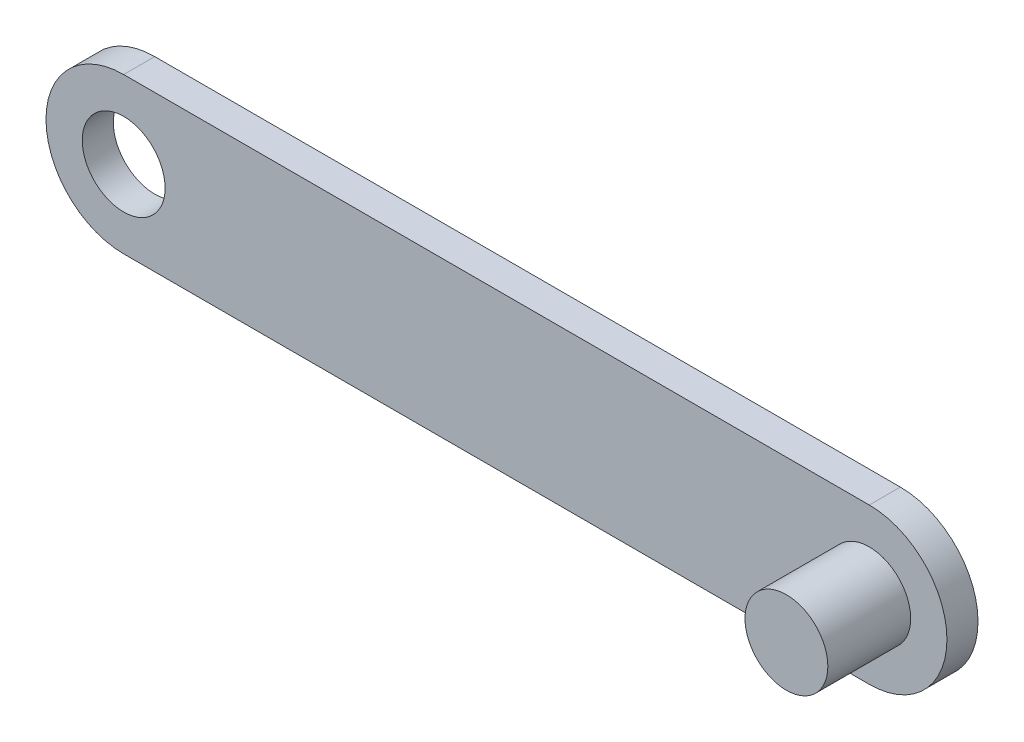
from build123d import *

# Parameters (mm, degrees)
BOSS_EXTRUDE4_DEPTH = 3
SKETCH4_R           = 4
CUT_EXTRUDE1_DEPTH  = 80.909323611
SKETCH5_R           = 4
BOSS_EXTRUDE5_DEPTH = 8


with BuildPart() as part:
    # Sketch1 → Boss-Extrude4 (new body)
    with BuildSketch(Plane.XY):
        with BuildLine():
            Line((0, 7.5), (72, 7.5))
            ThreePointArc((72, 7.5), (79.5, 0), (72, -7.5))
            Line((72, -7.5), (0, -7.5))
            ThreePointArc((0, -7.5), (-7.5, 0), (0, 7.5))
        make_face()
    extrude(amount=BOSS_EXTRUDE4_DEPTH)

    # Sketch4 → Cut-Extrude1 (cut, through all)
    with BuildSketch(Plane.XY.offset(3)):
        Circle(SKETCH4_R)
    extrude(amount=-CUT_EXTRUDE1_DEPTH, mode=Mode.SUBTRACT)

    # Sketch5 → Boss-Extrude5 (add)
    with BuildSketch(Plane.XY.offset(3)):
        with Locations((72, 0)):
            Circle(SKETCH5_R)
    extrude(amount=BOSS_EXTRUDE5_DEPTH)


solid = part.part
